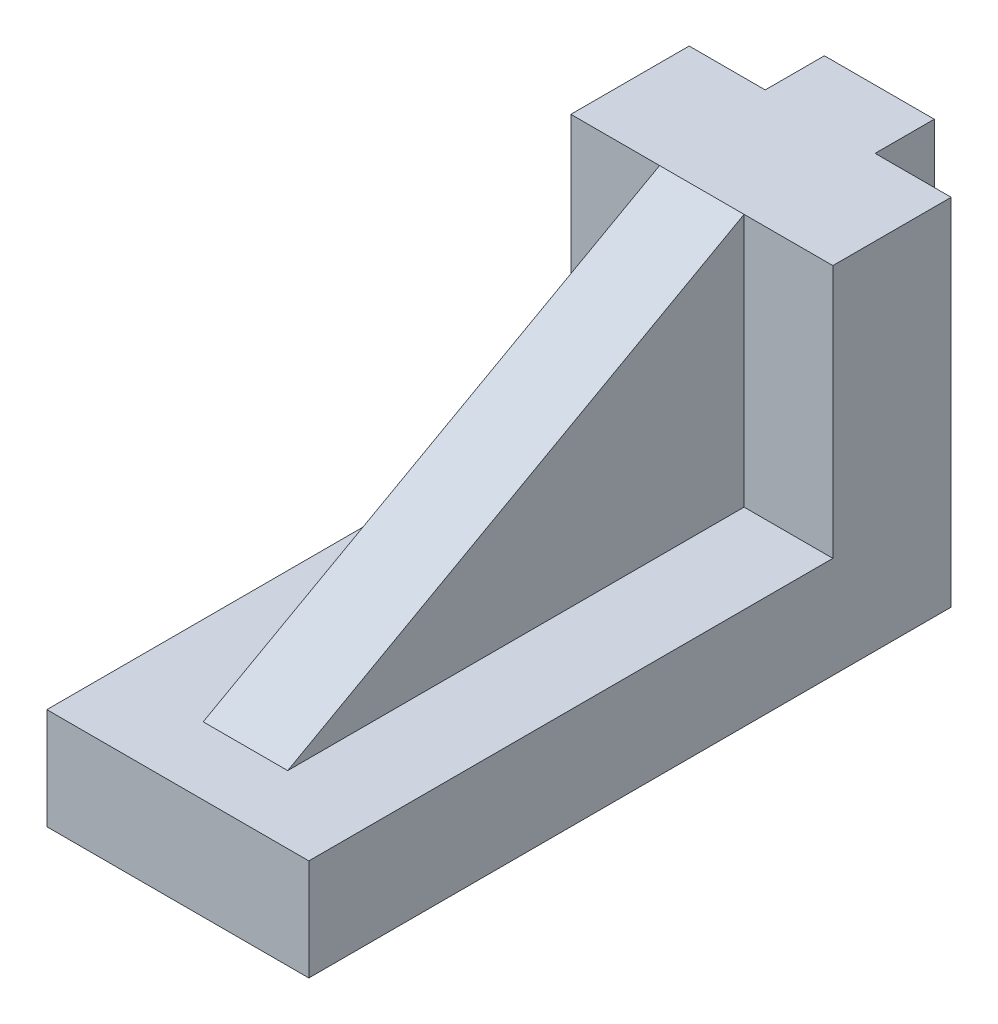
from build123d import *

# Parameters (mm, degrees)
SALIENTE_EXTRUIR1_DEPTH = 15.5
CROQUIS2_W              = 13
CROQUIS2_H              = 7
SALIENTE_EXTRUIR2_DEPTH = 42
NERVIO1_REACH           = 90.206
CROQUIS3_WALL_W         = 240.185231722
CROQUIS3_WALL_H         = 10


with BuildPart() as part:
    # Croquis1 → Saliente-Extruir1 (new, symmetric)
    with BuildSketch(Plane(origin=(0, 0, 0), x_dir=(0, 0, -1), z_dir=(1, 0, 0))):
        Polygon((0, 0), (-76, 0), (-76, 12), (-14, 12), (-14, 42), (0, 42), align=None)
    extrude(amount=SALIENTE_EXTRUIR1_DEPTH, both=True)

    # Croquis2 → Saliente-Extruir2 (add)
    with BuildSketch(Plane(origin=(0, 42, 0), x_dir=(1, 0, 0), z_dir=(0, 1, 0))):
        with Locations((0, 3.5)):
            Rectangle(CROQUIS2_W, CROQUIS2_H)
    extrude(amount=-SALIENTE_EXTRUIR2_DEPTH)

    # Croquis3 wall → Nervio1 (add, up to next)
    with BuildSketch(Plane(origin=(0, 27, 41), x_dir=(0, 0.485642931179, -0.874157276122), z_dir=(0, 0.874157276122, 0.485642931179)), mode=Mode.PRIVATE) as nervio1_sk1:
        Rectangle(CROQUIS3_WALL_W, CROQUIS3_WALL_H)
    nervio1_tool1 = extrude(nervio1_sk1.sketch, amount=-NERVIO1_REACH, mode=Mode.PRIVATE) - part.part
    add(nervio1_tool1.solids().sort_by_distance((0, 27, 41))[0])


solid = part.part
